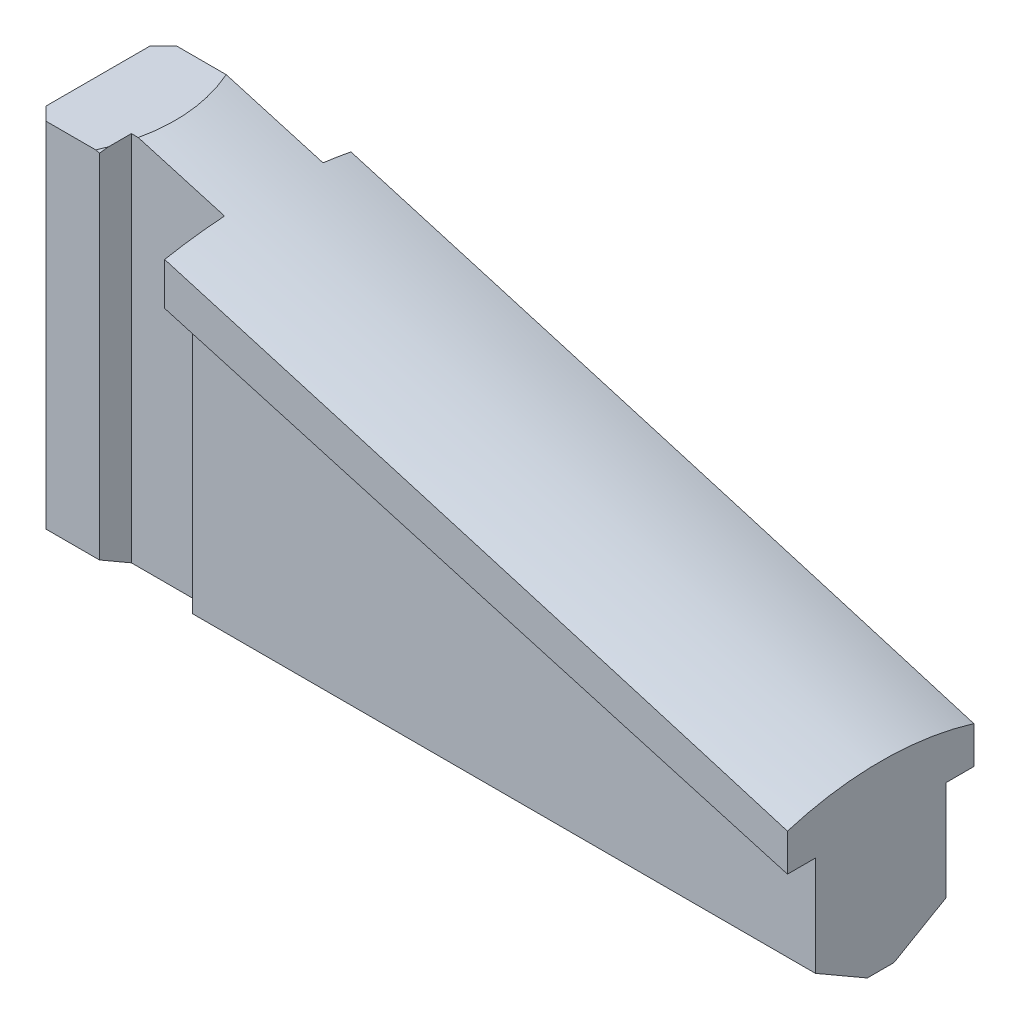
from build123d import *

# Parameters (mm, degrees)
R_VOLUTION1_ANGLE       = 180
ESQUISSE3_OUTSIDE_W     = 53.726
ESQUISSE3_OUTSIDE_H     = 33.296
ENL_V_MAT_EXTRU_1_DEPTH = 42.220813774
ESQUISSE4_W             = 1.05
ESQUISSE4_H             = 30
ESQUISSE6_W             = 6
ESQUISSE6_H             = 1.05
ENL_V_MAT_EXTRU_2_DEPTH = 33.923699671
CHANFREIN1_SIZE         = 0.5


with BuildPart() as part:
    # Esquisse1 → Révolution1 (revolve, symmetric)
    with BuildSketch(Plane.XY) as r_volution1_sk:
        Polygon((0, 20.430314341), (0, 0), (29.4, 0), (29.4, 12), align=None)
    revolve(axis=Axis((0, 0, 0), (-1, 0, 0)), revolution_arc=R_VOLUTION1_ANGLE / 2)
    revolve(r_volution1_sk.sketch, axis=Axis((0, 0, 0), (1, 0, 0)), revolution_arc=R_VOLUTION1_ANGLE / 2)

    # Esquisse3 outside → Enlèv. mat.-Extru.1 (cut, through all)
    with BuildSketch(Plane(origin=(29.4, 0, 0), x_dir=(0, 0, -1), z_dir=(1, 0, 0))):
        with Locations((0, 10.215)):
            Rectangle(ESQUISSE3_OUTSIDE_W, ESQUISSE3_OUTSIDE_H)
        Polygon((-3.5, 6.932050808), (-0.5, 5.2), (0.5, 5.2), (3.5, 6.932050808), (3.5, 19.6), (-3.5, 19.6), align=None, mode=Mode.SUBTRACT)
    extrude(amount=-ENL_V_MAT_EXTRU_1_DEPTH, mode=Mode.SUBTRACT)

    # Enlèvement de matière-Balayage1: sweep along a path in Esquisse5
    with BuildLine(Plane(origin=(0, 0, 0), x_dir=(-1, 0, 0), z_dir=(0, 0, -1))) as enl_vement_de_mati_re_balayage1_path:
        Line((-29.4, 10.078240283), (0, 18.508554625))
    # Esquisse4 → Enlèvement de matière-Balayage1 (sweep, cut)
    with BuildSketch(Plane(origin=(29.4, 0, 0), x_dir=(0, 0, -1), z_dir=(1, 0, 0))):
        with Locations((2.975, -4.921759717)):
            Rectangle(ESQUISSE4_W, ESQUISSE4_H)
        with Locations((-2.975, -4.921759717)):
            Rectangle(ESQUISSE4_W, ESQUISSE4_H)
    sweep(path=enl_vement_de_mati_re_balayage1_path.line, mode=Mode.SUBTRACT)

    # Esquisse6 → Enlèv. mat.-Extru.2 (cut, through all)
    with BuildSketch(Plane(origin=(0, 19.6, 0), x_dir=(-1, 0, 0), z_dir=(0, 1, 0))):
        with Locations((-3, -2.975)):
            Rectangle(ESQUISSE6_W, ESQUISSE6_H)
        Polygon((0, 3.5), (-6, 3.5), (-6, 2.45), (-6, 1.25), (-2.5, 1.25), (-2.5, 2.45), (0, 2.45), align=None)
    extrude(amount=-ENL_V_MAT_EXTRU_2_DEPTH, mode=Mode.SUBTRACT)

    # Chanfrein1
    chanfrein1_edges = [part.edges().sort_by_distance(p)[0] for p in [
        (0, 12.962916512, -2.45),
        (0, 12.962916512, 2.45),
    ]]
    chamfer(chanfrein1_edges, length=CHANFREIN1_SIZE)


solid = part.part
